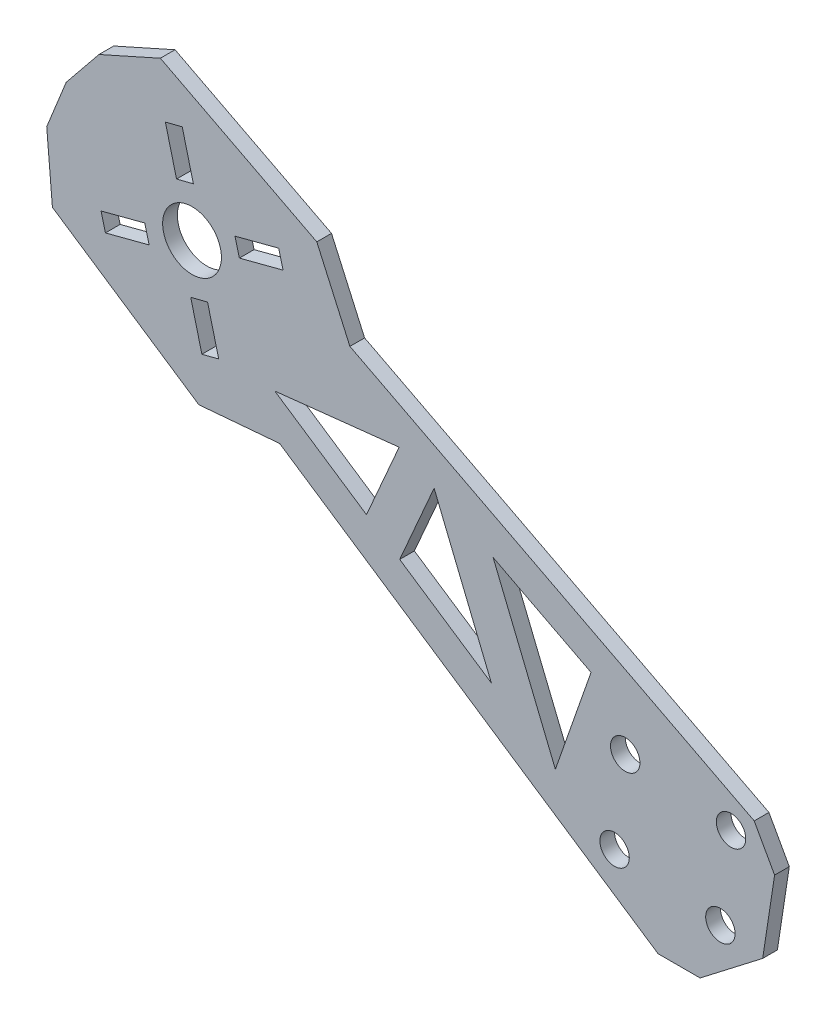
from build123d import *

# Parameters (mm, degrees)
SKETCH1_R           = 4
SKETCH1_R_2         = 2
BOSS_EXTRUDE1_DEPTH = 2
CUT_EXTRUDE1_DEPTH  = 173.793238563


with BuildPart() as part:
    # Sketch1 → Boss-Extrude1 (new body)
    with BuildSketch(Plane.XY):
        Polygon((-12.69170221, 68.058974673), (-21.206087924, 61.497173254), (-26.925864701, 61.497173254), (-78.416756166, 95.875975746), (-89.405776689, 94.940877802), (-109.330638194, 108.244063256), (-110.106321881, 117.359690148), (-107.452090358, 123.920131464), (-102.997288795, 129.41913849), (-94.646003522, 133.154426043), (-73.358414132, 122.162911716), (-68.855470773, 112.095316109), (-13.842945112, 83.690457631), (-11.073314648, 78.685960307), align=None)
        with Locations((-90.332829692, 113.828343926)):
            Circle(SKETCH1_R, mode=Mode.SUBTRACT)
        with Locations((-18.448275862, 69.087716549)):
            Circle(SKETCH1_R_2, mode=Mode.SUBTRACT)
        with Locations((-32.842285033, 70.837716549)):
            Circle(SKETCH1_R_2, mode=Mode.SUBTRACT)
        with Locations((-31.39400917, 82.75)):
            Circle(SKETCH1_R_2, mode=Mode.SUBTRACT)
        with Locations((-17, 81)):
            Circle(SKETCH1_R_2, mode=Mode.SUBTRACT)
        Polygon((-102.715959344, 111.122206654), (-96.771854102, 112.676201947), (-96.173964404, 110.389245671), (-102.118069647, 108.835250378), align=None, mode=Mode.SUBTRACT)
        Polygon((-91.670790351, 126.557551491), (-90.152197928, 120.604303172), (-92.442671943, 120.0200345), (-93.961264367, 125.97328282), align=None, mode=Mode.SUBTRACT)
        Polygon((-77.94970004, 116.534481198), (-83.893805282, 114.980485905), (-84.49169498, 117.267442181), (-78.547589737, 118.821437474), align=None, mode=Mode.SUBTRACT)
        Polygon((-88.222987441, 107.636653352), (-90.513461456, 107.052384681), (-88.994869033, 101.099136361), (-86.704395017, 101.683405032), align=None, mode=Mode.SUBTRACT)
    extrude(amount=BOSS_EXTRUDE1_DEPTH)

    # Sketch5 → Cut-Extrude1 (cut, through all)
    with BuildSketch(Plane(origin=(0, 0, 0), x_dir=(-1, 0, 0), z_dir=(0, 0, -1))):
        Polygon((40.900602426, 76.238480364), (36.043275579, 90.088799545), (49.371469789, 96.970604475), align=None)
        Polygon((49.606538592, 82.051152303), (57.395163154, 101.113513236), (62.081526665, 90.380298271), align=None)
        Polygon((62.153457083, 103.570383994), (66.596381061, 93.394720495), (79.071369134, 101.723866464), align=None)
    extrude(amount=-CUT_EXTRUDE1_DEPTH, mode=Mode.SUBTRACT)


solid = part.part
